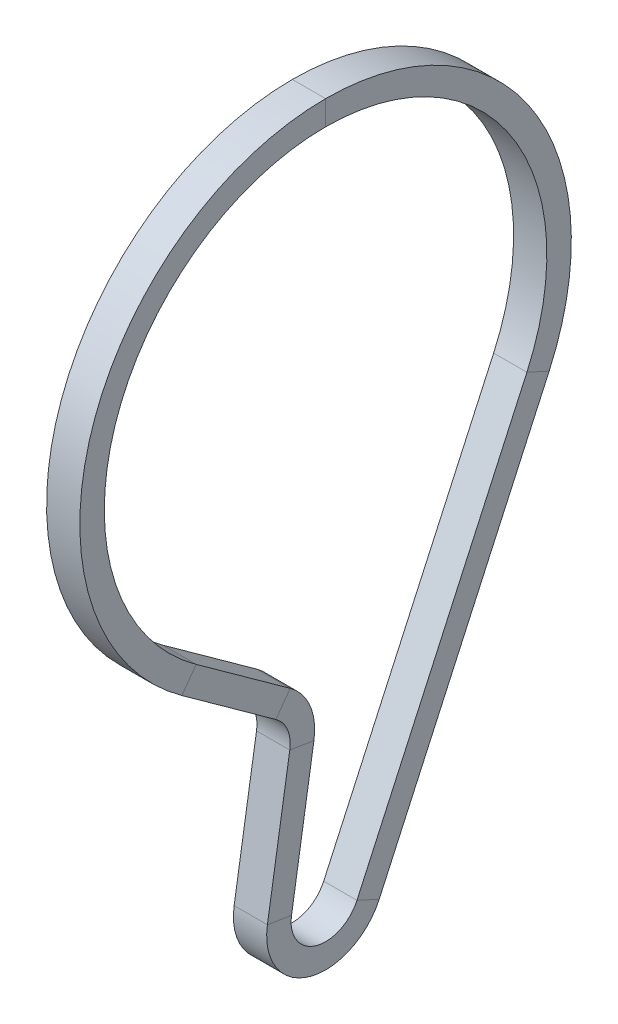
from build123d import *

# Parameters (mm, degrees)
SKETCH2_W = 12.954
SKETCH2_H = 9.525


with BuildPart() as part:
    # Sweep1: sweep along a path in Sketch1
    with BuildLine(Plane(origin=(0, 0, 0), x_dir=(0, 0, -1), z_dir=(1, 0, 0))) as sweep1_path:
        Line((16.54938381, -182.81283345), (82.746919051, -37.764167251))
        ThreePointArc((82.746919051, -37.764167251), (-23.298735464, 87.922430962), (-53.187131299, -73.785594832))
        Line((-53.187131299, -73.785594832), (-16.57165453, -100.179258458))
        ThreePointArc((-16.57165453, -100.179258458), (-10.410929492, -107.954292451), (-9.245359354, -117.80554277))
        Line((-9.245359354, -117.80554277), (-17.963721436, -172.390834655))
        ThreePointArc((-17.963721436, -172.390834655), (-5.258764347, -192.674729259), (16.54938381, -182.81283345))
    # Sketch2 → Sweep1 (sweep)
    with BuildSketch(Plane.XY):
        with Locations((0, 90.957049977)):
            Rectangle(SKETCH2_W, SKETCH2_H)
    sweep(path=sweep1_path.line)


solid = part.part
